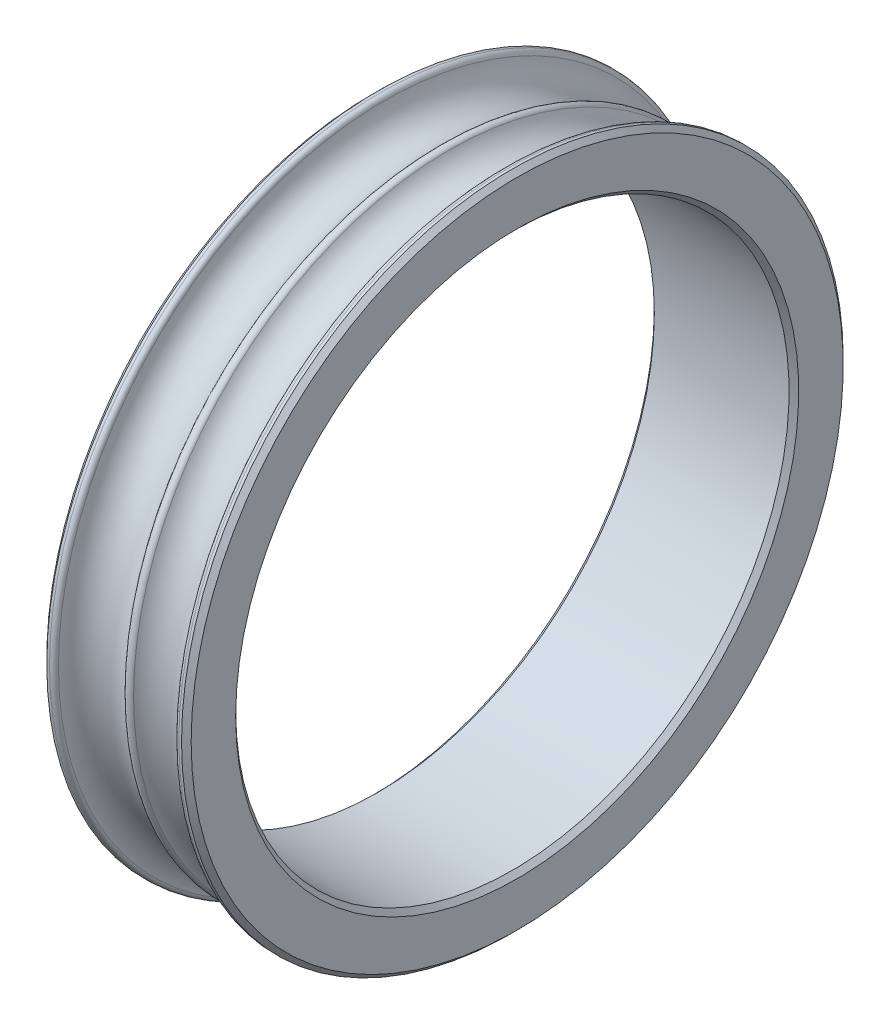
from build123d import *

# Parameters (mm, degrees)
FILLET_1_R     = 0.4
CHAMFER_1_SIZE = 0.4


with BuildPart() as part:
    # 草图1 → 旋转1 (revolve)
    with BuildSketch(Plane.XY, mode=Mode.PRIVATE) as revolve_1_sk:
        with BuildLine():
            Line((6, 23), (0, 23))
            Line((0, 23), (-6, 23))
            Line((-6, 23), (-6, 27.5))
            Line((-6, 27.5), (-5, 27.5))
            ThreePointArc((-5, 27.5), (-2.5, 25), (0, 27.5))
            ThreePointArc((0, 27.5), (2.5, 25), (5, 27.5))
            Line((5, 27.5), (6, 27.5))
            Line((6, 27.5), (6, 23))
        make_face()
    revolve(revolve_1_sk.sketch.rotate(Axis((-16.580648815, 0, 0), (1, 0, 0)), 90), axis=Axis((-16.580648815, 0, 0), (1, 0, 0)))

    # 圆角1
    fillet_1_edges = [part.edges().sort_by_distance(p)[0] for p in [
        (0, 0, -27.5),
        (5, 0, -27.5),
        (-5, 0, -27.5),
    ]]
    fillet(fillet_1_edges, radius=FILLET_1_R)

    # 倒角1
    chamfer_1_edges = [part.edges().sort_by_distance(p)[0] for p in [
        (6, 0, -27.5),
        (6, 0, -23),
        (-6, 0, -23),
        (-6, 0, -27.5),
    ]]
    chamfer(chamfer_1_edges, length=CHAMFER_1_SIZE)


solid = part.part
